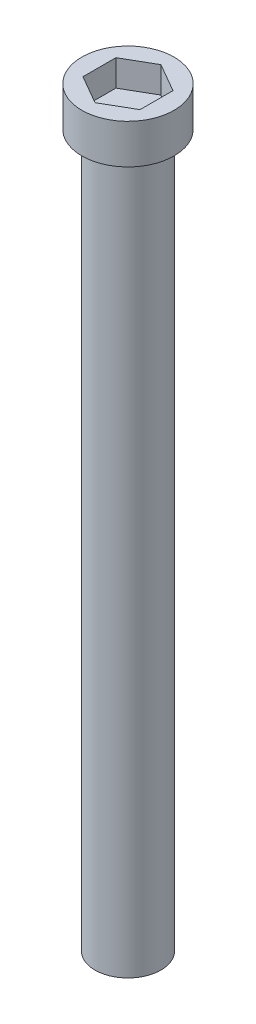
from build123d import *

# Parameters (mm, degrees)
SKETCH1_R          = 2.5
SCREW_LENGTH_DEPTH = 54
SKETCH2_R          = 3.5
SCREW_CAP_DEPTH    = 3
SCREW_HOLE_DEPTH   = 2


with BuildPart() as part:
    # Sketch1 → Screw Length (new body)
    with BuildSketch(Plane(origin=(0, 0, 0), x_dir=(1, 0, 0), z_dir=(0, 1, 0))):
        with Locations(Location((0, 0, 0), (0, 0, 270))):
            Circle(SKETCH1_R)
    extrude(amount=SCREW_LENGTH_DEPTH)

    # Sketch2 → Screw Cap (add)
    with BuildSketch(Plane(origin=(0, 54, 0), x_dir=(1, 0, 0), z_dir=(0, 1, 0))):
        with Locations(Location((0, 0, 0), (0, 0, 270))):
            Circle(SKETCH2_R)
    extrude(amount=SCREW_CAP_DEPTH)

    # Sketch3 → Screw Hole (cut)
    with BuildSketch(Plane(origin=(0, 57, 0), x_dir=(1, 0, 0), z_dir=(0, 1, 0))):
        Polygon((0, 2.5), (-2.165063509, 1.25), (-2.165063509, -1.25), (0, -2.5), (2.165063509, -1.25), (2.165063509, 1.25), align=None)
    extrude(amount=-SCREW_HOLE_DEPTH, mode=Mode.SUBTRACT)


solid = part.part
